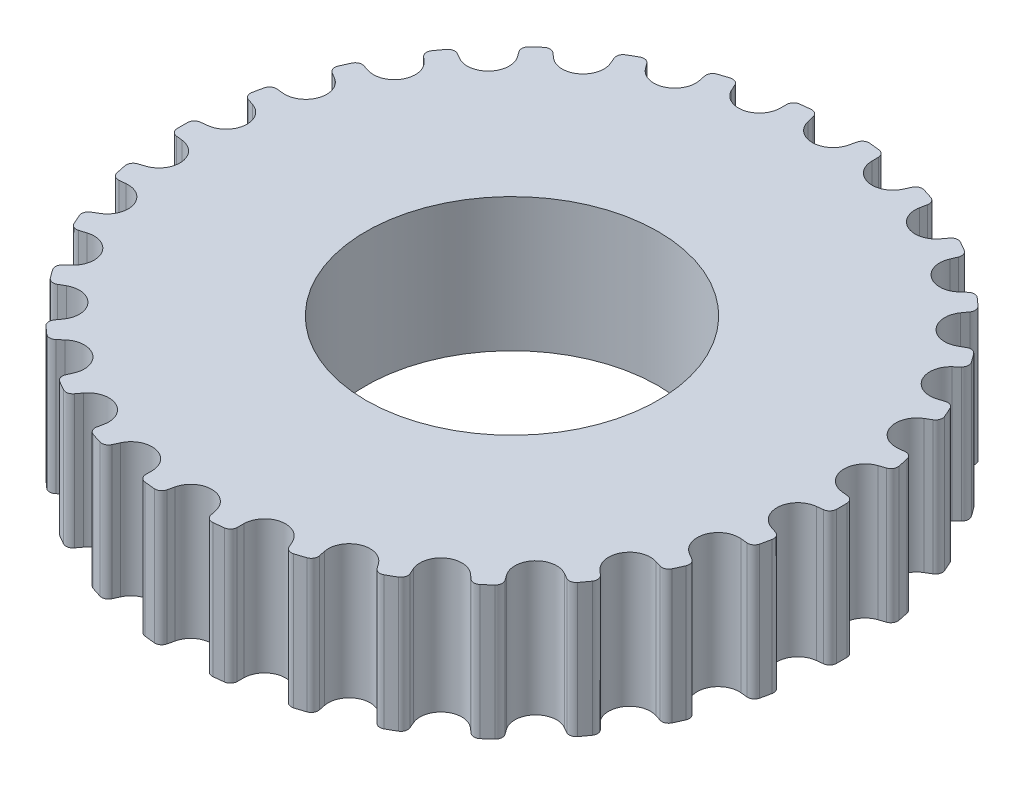
from build123d import *

# Parameters (mm, degrees)
SKETCH1_R           = 14.323944878
BOSS_EXTRUDE1_DEPTH = 5.8
CUT_EXTRUDE1_DEPTH  = 22.07108905
CIRPATTERN1_COUNT   = 30
SKETCH3_R           = 6.35
CUT_EXTRUDE2_DEPTH  = 22.033616305


with BuildPart() as part:
    # Sketch1 → Boss-Extrude1 (new body)
    with BuildSketch(Plane(origin=(0, 0, 0), x_dir=(1, 0, 0), z_dir=(0, 1, 0))):
        with Locations(Location((0, 0, 0), (0, 0, 270))):
            Circle(SKETCH1_R)
    extrude(amount=BOSS_EXTRUDE1_DEPTH)

    # Sketch2 → Cut-Extrude1 (cut, through all)
    with BuildSketch(Plane(origin=(0, 5.8, 0), x_dir=(1, 0, 0), z_dir=(0, 1, 0))):
        with BuildLine():
            Line((-0.88830444, 13.756422166), (-0.95, 14.033881093))
            ThreePointArc((-0.95, 14.033881093), (-1.065709647, 14.210883809), (-1.269434594, 14.267583281))
            ThreePointArc((-1.269434594, 14.267583281), (-2.127648488, 14.165045315), (-2.978115599, 14.010932316))
            Line((-2.978115599, 14.010932316), (-2.978115599, 14.323944878))
            Line((-2.978115599, 14.323944878), (2.978115599, 14.323944878))
            Line((2.978115599, 14.323944878), (2.978115599, 14.010932316))
            ThreePointArc((2.978115599, 14.010932316), (2.127648488, 14.165045315), (1.269434594, 14.267583281))
            ThreePointArc((1.269434594, 14.267583281), (1.065709647, 14.210883809), (0.95, 14.033881093))
            Line((0.95, 14.033881093), (0.88830444, 13.756422166))
            ThreePointArc((0.88830444, 13.756422166), (0, 13.043944878), (-0.88830444, 13.756422166))
        make_face()
    cut_extrude1 = extrude(amount=-CUT_EXTRUDE1_DEPTH, mode=Mode.SUBTRACT)

    # CirPattern1: Cut-Extrude1 ×30 about axis
    cirpattern1_axis = Axis((0, 0, 0), (0, 1, 0))
    for i in range(1, CIRPATTERN1_COUNT):
        add(cut_extrude1.rotate(cirpattern1_axis, i * 360 / CIRPATTERN1_COUNT), mode=Mode.SUBTRACT)

    # Sketch3 → Cut-Extrude2 (cut, through all)
    with BuildSketch(Plane.XZ):
        with Locations(Location((0, 0, 0), (0, 0, 270))):
            Circle(SKETCH3_R)
    extrude(amount=-CUT_EXTRUDE2_DEPTH, mode=Mode.SUBTRACT)


solid = part.part
